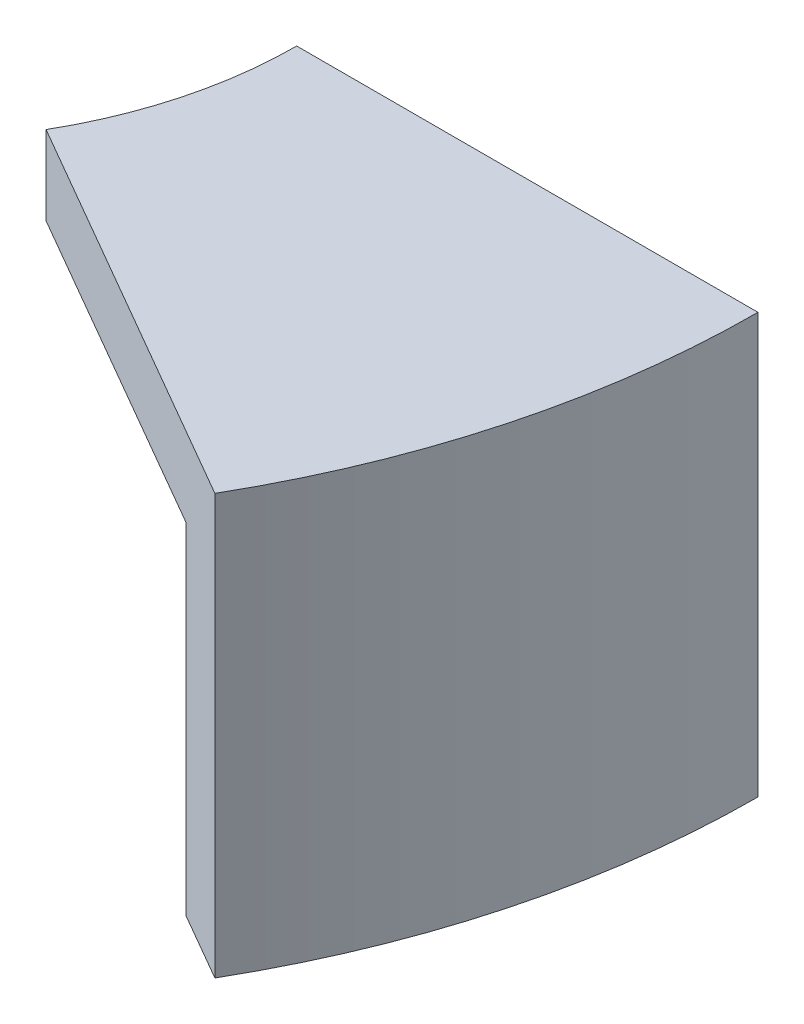
from build123d import *

# Parameters (mm, degrees)
REVOLVE1_ANGLE = 30


with BuildPart() as part:
    # Sketch1 → Revolve1 (revolve)
    with BuildSketch(Plane.XY):
        Polygon((297.869910117, 906.559895472), (332.869910117, 906.559895472), (332.869910117, 902.559895472), (332.869910117, 874.70937118), (326.869910117, 874.70937118), (326.869910117, 900.559895472), (297.869910117, 900.559895472), align=None)
    revolve(axis=Axis((267.869910117, 911.559895472, 0), (0, -1, 0)), revolution_arc=REVOLVE1_ANGLE)


solid = part.part
